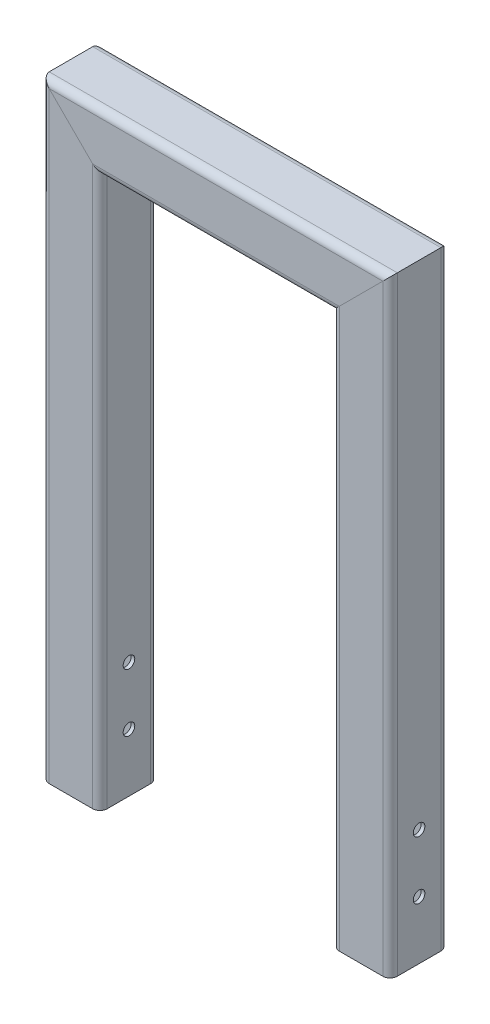
from build123d import *

# Parameters (mm, degrees)
SQUARE_TUBE_80_X_80_X_5_1_DEPTH   = 857.568542495
SQUARE_TUBE_80_X_80_X_5_1_2_DEPTH = 515.13708499
SQUARE_TUBE_80_X_80_X_5_1_3_DEPTH = 857.568542495
CUT_EXTRUDE1_START                = -480
SKETCH112_R                       = 8
CUT_EXTRUDE1_DEPTH                = 480


with BuildPart() as part:
    # Sketch1 → Square tube 80 X 80 X 5(1) (new body)
    with BuildSketch(Plane(origin=(0, 0, 0), x_dir=(1, 0, 0), z_dir=(0, 1, 0))):
        with BuildLine():
            Line((-30, -40), (30, -40))
            ThreePointArc((30, -40), (37.071067812, -37.071067812), (40, -30))
            Line((40, -30), (40, 30))
            ThreePointArc((40, 30), (37.071067812, 37.071067812), (30, 40))
            Line((30, 40), (-30, 40))
            ThreePointArc((-30, 40), (-37.071067812, 37.071067812), (-40, 30))
            Line((-40, 30), (-40, -30))
            ThreePointArc((-40, -30), (-37.071067812, -37.071067812), (-30, -40))
        make_face()
        with BuildLine():
            Line((-30, -35), (30, -35))
            ThreePointArc((30, -35), (33.535533906, -33.535533906), (35, -30))
            Line((35, -30), (35, 30))
            ThreePointArc((35, 30), (33.535533906, 33.535533906), (30, 35))
            Line((30, 35), (-30, 35))
            ThreePointArc((-30, 35), (-33.535533906, 33.535533906), (-35, 30))
            Line((-35, 30), (-35, -30))
            ThreePointArc((-35, -30), (-33.535533906, -33.535533906), (-30, -35))
        make_face(mode=Mode.SUBTRACT)
    extrude(amount=SQUARE_TUBE_80_X_80_X_5_1_DEPTH)

    # Square tube 80 X 80 X 5(1) mitre 1
    split(bisect_by=Plane(origin=(0, 800, 0), x_dir=(0.707106781, -0.707106781, 0), z_dir=(-0.707106781, -0.707106781, 0)), keep=Keep.TOP)


with BuildPart() as body_2:
    # Sketch1 on segment 2 (carried to segment 2) → Square tube 80 X 80 X 5_1 2 (new body)
    with BuildSketch(Plane(origin=(-57.568542495, 800, 0), x_dir=(0, -1, 0), z_dir=(1, 0, 0))):
        with BuildLine():
            Line((-30, -40), (30, -40))
            ThreePointArc((30, -40), (37.071067812, -37.071067812), (40, -30))
            Line((40, -30), (40, 30))
            ThreePointArc((40, 30), (37.071067812, 37.071067812), (30, 40))
            Line((30, 40), (-30, 40))
            ThreePointArc((-30, 40), (-37.071067812, 37.071067812), (-40, 30))
            Line((-40, 30), (-40, -30))
            ThreePointArc((-40, -30), (-37.071067812, -37.071067812), (-30, -40))
        make_face()
        with BuildLine():
            Line((-30, -35), (30, -35))
            ThreePointArc((30, -35), (33.535533906, -33.535533906), (35, -30))
            Line((35, -30), (35, 30))
            ThreePointArc((35, 30), (33.535533906, 33.535533906), (30, 35))
            Line((30, 35), (-30, 35))
            ThreePointArc((-30, 35), (-33.535533906, 33.535533906), (-35, 30))
            Line((-35, 30), (-35, -30))
            ThreePointArc((-35, -30), (-33.535533906, -33.535533906), (-30, -35))
        make_face(mode=Mode.SUBTRACT)
    extrude(amount=SQUARE_TUBE_80_X_80_X_5_1_2_DEPTH)

    # Square tube 80 X 80 X 5_1 2 mitre 1
    split(bisect_by=Plane(origin=(0, 800, 0), x_dir=(-0.707106781, 0.707106781, 0), z_dir=(0.707106781, 0.707106781, 0)), keep=Keep.TOP)

    # Square tube 80 X 80 X 5_1 2 mitre 2
    split(bisect_by=Plane(origin=(400, 800, 0), x_dir=(-0.707106781, -0.707106781, 0), z_dir=(-0.707106781, 0.707106781, 0)), keep=Keep.TOP)


with BuildPart() as body_3:
    # Sketch1 on segment 3 (carried to segment 3) → Square tube 80 X 80 X 5_1 3 (new body)
    with BuildSketch(Plane(origin=(400, 857.568542495, 0), x_dir=(-1, 0, 0), z_dir=(0, -1, 0))):
        with BuildLine():
            Line((-30, -40), (30, -40))
            ThreePointArc((30, -40), (37.071067812, -37.071067812), (40, -30))
            Line((40, -30), (40, 30))
            ThreePointArc((40, 30), (37.071067812, 37.071067812), (30, 40))
            Line((30, 40), (-30, 40))
            ThreePointArc((-30, 40), (-37.071067812, 37.071067812), (-40, 30))
            Line((-40, 30), (-40, -30))
            ThreePointArc((-40, -30), (-37.071067812, -37.071067812), (-30, -40))
        make_face()
        with BuildLine():
            Line((-30, -35), (30, -35))
            ThreePointArc((30, -35), (33.535533906, -33.535533906), (35, -30))
            Line((35, -30), (35, 30))
            ThreePointArc((35, 30), (33.535533906, 33.535533906), (30, 35))
            Line((30, 35), (-30, 35))
            ThreePointArc((-30, 35), (-33.535533906, 33.535533906), (-35, 30))
            Line((-35, 30), (-35, -30))
            ThreePointArc((-35, -30), (-33.535533906, -33.535533906), (-30, -35))
        make_face(mode=Mode.SUBTRACT)
    extrude(amount=SQUARE_TUBE_80_X_80_X_5_1_3_DEPTH)

    # Square tube 80 X 80 X 5_1 3 mitre 1
    split(bisect_by=Plane(origin=(400, 800, 0), x_dir=(0.707106781, 0.707106781, 0), z_dir=(0.707106781, -0.707106781, 0)), keep=Keep.TOP)


with BuildPart() as cut_extrude1_tool:
    # Sketch112 → Cut-Extrude1 (new body)
    with BuildSketch(Plane(origin=(440, 0, 0), x_dir=(0, 0, -1), z_dir=(1, 0, 0)).offset(CUT_EXTRUDE1_START)):
        with Locations(Location((0, 160, 0), (0, 0, 270))):
            Circle(SKETCH112_R)
        with Locations(Location((0, 80, 0), (0, 0, 270))):
            Circle(SKETCH112_R)
    extrude(amount=CUT_EXTRUDE1_DEPTH)


with BuildPart() as part_1:
    add(part.part)

    # Cut-Extrude1: cut by cut_extrude1_tool
    add(cut_extrude1_tool.part, mode=Mode.SUBTRACT)


with BuildPart() as body_3_1:
    add(body_3.part)

    # Cut-Extrude1: cut by cut_extrude1_tool
    add(cut_extrude1_tool.part, mode=Mode.SUBTRACT)


solid = Compound([body_2.part, part_1.part, body_3_1.part])
